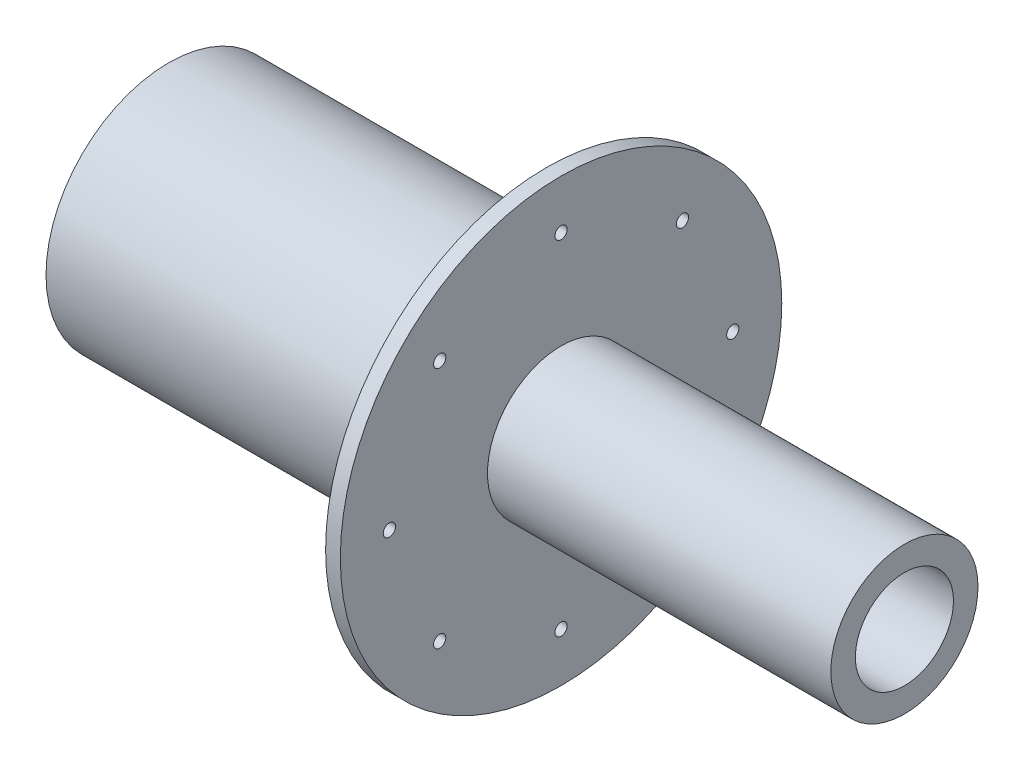
from build123d import *

# Parameters (mm, degrees)
SKETCH1_R                   = 25
SKETCH1_R_2                 = 10
BOSS_EXTRUDE1_DEPTH         = 80
SKETCH1_3_R                 = 15
SKETCH1_3_R_2               = 10
BOSS_EXTRUDE2_DEPTH         = 70
SKETCH1_4_R                 = 45
SKETCH1_4_R_2               = 25
BOSS_EXTRUDE3_DEPTH         = 3
M3_TAPPED_HOLE1_D           = 2.5
M3_TAPPED_HOLE1_CSINK_D     = 3.05
M3_TAPPED_HOLE1_CSINK_ANGLE = 90


with BuildPart() as part:
    # Sketch1 → Boss-Extrude1 (new body)
    with BuildSketch(Plane(origin=(0, 0, 0), x_dir=(0, 0, -1), z_dir=(1, 0, 0))):
        Circle(SKETCH1_R)
        Circle(SKETCH1_R_2, mode=Mode.SUBTRACT)
    extrude(amount=-BOSS_EXTRUDE1_DEPTH)



with BuildPart() as body_2:
    # Sketch1<3> → Boss-Extrude2 (new body)
    with BuildSketch(Plane(origin=(0, 0, 0), x_dir=(0, 0, -1), z_dir=(1, 0, 0))):
        Circle(SKETCH1_3_R)
        Circle(SKETCH1_3_R_2, mode=Mode.SUBTRACT)
    extrude(amount=BOSS_EXTRUDE2_DEPTH)


with BuildPart() as part_1:
    add(part.part)

    add(body_2.part)  # Boss-Extrude3 merges body 2
    # Sketch1<4> → Boss-Extrude3 (add)
    with BuildSketch(Plane(origin=(0, 0, 0), x_dir=(0, 0, -1), z_dir=(1, 0, 0))):
        Circle(SKETCH1_4_R)
        Circle(SKETCH1_4_R_2, mode=Mode.SUBTRACT)
    extrude(amount=-BOSS_EXTRUDE3_DEPTH)

    # M3 Tapped Hole1 (through all)
    with Locations(Plane.ZY.offset(3)):
        with Locations((35, 0), (0, 35), (-35, 0), (0, -35), (24.748737342, 24.748737342), (-24.748737342, 24.748737342), (-24.748737342, -24.748737342), (24.748737342, -24.748737342)):
            CounterSinkHole(M3_TAPPED_HOLE1_D / 2, M3_TAPPED_HOLE1_CSINK_D / 2, counter_sink_angle=M3_TAPPED_HOLE1_CSINK_ANGLE)


solid = part_1.part
